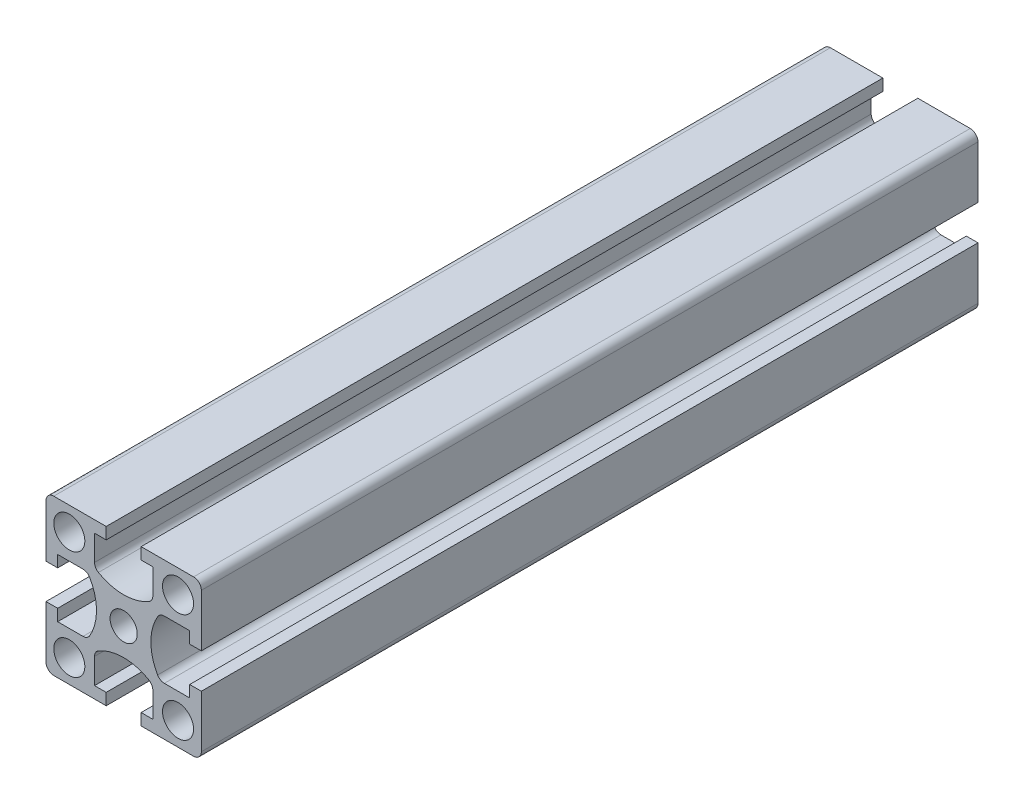
from build123d import *

# Parameters (mm, degrees)
SKETCH1_R           = 2
SKETCH1_R_2         = 1.75
BOSS_EXTRUDE1_DEPTH = 100


with BuildPart() as part:
    # Sketch1 → Boss-Extrude1 (new body)
    with BuildSketch(Plane.XY):
        with BuildLine():
            Line((-10, 9), (-10, 2.25))
            Line((-10, 2.25), (-8.5, 2.25))
            Line((-8.5, 2.25), (-8.5, 3.75))
            Line((-8.5, 3.75), (-5.236860279, 3.75))
            ThreePointArc((-5.236860279, 3.75), (-4.736860279, 3.616025404), (-4.370834875, 3.25))
            ThreePointArc((-4.370834875, 3.25), (-3.5, 0), (-4.370834875, -3.25))
            ThreePointArc((-4.370834875, -3.25), (-4.736860279, -3.616025404), (-5.236860279, -3.75))
            Line((-5.236860279, -3.75), (-8.5, -3.75))
            Line((-8.5, -3.75), (-8.5, -2.25))
            Line((-8.5, -2.25), (-10, -2.25))
            Line((-10, -2.25), (-10, -9))
            ThreePointArc((-10, -9), (-9.707106781, -9.707106781), (-9, -10))
            Line((-9, -10), (-2.25, -10))
            Line((-2.25, -10), (-2.25, -8.5))
            Line((-2.25, -8.5), (-3.75, -8.5))
            Line((-3.75, -8.5), (-3.75, -5.236860279))
            ThreePointArc((-3.75, -5.236860279), (-3.616025404, -4.736860279), (-3.25, -4.370834875))
            ThreePointArc((-3.25, -4.370834875), (0, -3.5), (3.25, -4.370834875))
            ThreePointArc((3.25, -4.370834875), (3.616025404, -4.736860279), (3.75, -5.236860279))
            Line((3.75, -5.236860279), (3.75, -8.5))
            Line((3.75, -8.5), (2.25, -8.5))
            Line((2.25, -8.5), (2.25, -10))
            Line((2.25, -10), (9, -10))
            ThreePointArc((9, -10), (9.707106781, -9.707106781), (10, -9))
            Line((10, -9), (10, -2.25))
            Line((10, -2.25), (8.5, -2.25))
            Line((8.5, -2.25), (8.5, -3.75))
            Line((8.5, -3.75), (5.236860279, -3.75))
            ThreePointArc((5.236860279, -3.75), (4.736860279, -3.616025404), (4.370834875, -3.25))
            ThreePointArc((4.370834875, -3.25), (3.5, 0), (4.370834875, 3.25))
            ThreePointArc((4.370834875, 3.25), (4.736860279, 3.616025404), (5.236860279, 3.75))
            Line((5.236860279, 3.75), (8.5, 3.75))
            Line((8.5, 3.75), (8.5, 2.25))
            Line((8.5, 2.25), (10, 2.25))
            Line((10, 2.25), (10, 9))
            ThreePointArc((10, 9), (9.707106781, 9.707106781), (9, 10))
            Line((9, 10), (2.25, 10))
            Line((2.25, 10), (2.25, 8.5))
            Line((2.25, 8.5), (3.75, 8.5))
            Line((3.75, 8.5), (3.75, 5.236860279))
            ThreePointArc((3.75, 5.236860279), (3.616025404, 4.736860279), (3.25, 4.370834875))
            ThreePointArc((3.25, 4.370834875), (0, 3.5), (-3.25, 4.370834875))
            ThreePointArc((-3.25, 4.370834875), (-3.616025404, 4.736860279), (-3.75, 5.236860279))
            Line((-3.75, 5.236860279), (-3.75, 8.5))
            Line((-3.75, 8.5), (-2.25, 8.5))
            Line((-2.25, 8.5), (-2.25, 10))
            Line((-2.25, 10), (-9, 10))
            ThreePointArc((-9, 10), (-9.707106781, 9.707106781), (-10, 9))
        make_face()
        with Locations((-7, -7)):
            Circle(SKETCH1_R, mode=Mode.SUBTRACT)
        with Locations((7, -7)):
            Circle(SKETCH1_R, mode=Mode.SUBTRACT)
        with Locations((7, 7)):
            Circle(SKETCH1_R, mode=Mode.SUBTRACT)
        Circle(SKETCH1_R_2, mode=Mode.SUBTRACT)
        with Locations((-7, 7)):
            Circle(SKETCH1_R, mode=Mode.SUBTRACT)
    extrude(amount=BOSS_EXTRUDE1_DEPTH)


solid = part.part
